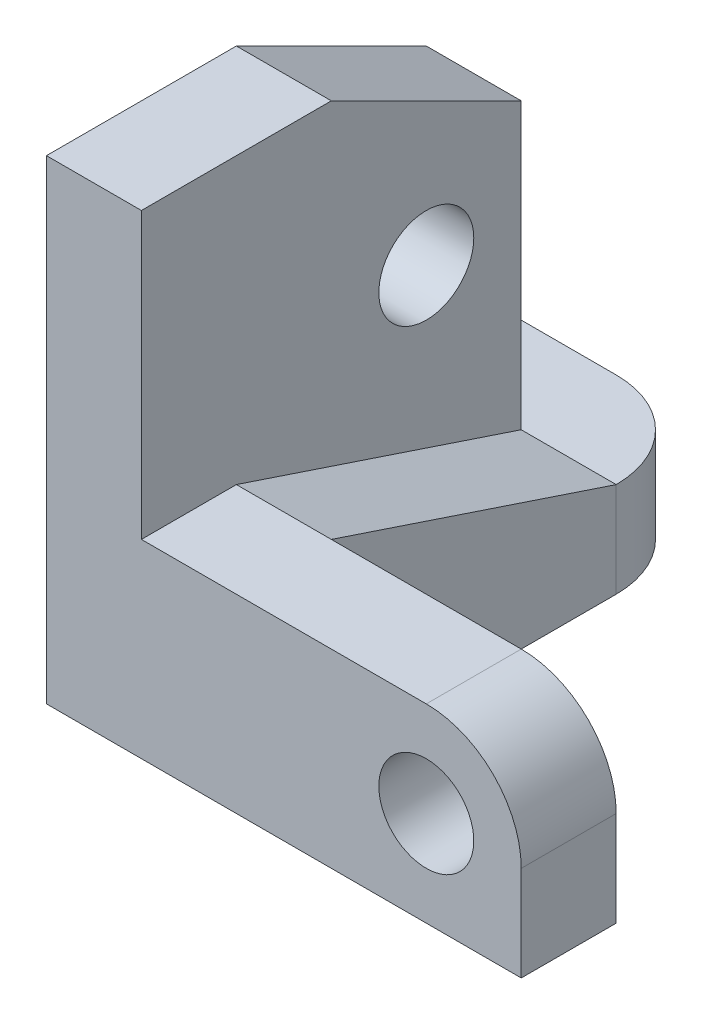
from build123d import *

# Parameters (mm, degrees)
SKETCH1_W           = 10
SKETCH1_H           = 20
BOSS_EXTRUDE1_DEPTH = 50
BOSS_EXTRUDE2_DEPTH = 20
SKETCH1_4_R         = 5
BOSS_EXTRUDE3_DEPTH = 10
FILLET1_R           = 10
SKETCH2_R           = 5
CUT_EXTRUDE1_DEPTH  = 10


with BuildPart() as part:
    # Sketch1 → Boss-Extrude1 (new body)
    with BuildSketch(Plane(origin=(0, 0, 0), x_dir=(0, 0, -1), z_dir=(1, 0, 0))):
        with Locations((-25, -20)):
            Rectangle(SKETCH1_W, SKETCH1_H)
    extrude(amount=BOSS_EXTRUDE1_DEPTH)

    # Sketch1<3> → Boss-Extrude2 (add)
    with BuildSketch(Plane(origin=(0, 0, 0), x_dir=(0, 0, -1), z_dir=(1, 0, 0))):
        Polygon((10, -20), (-20, -10), (-20, -30), (20, -30), (20, -20), align=None)
    extrude(amount=BOSS_EXTRUDE2_DEPTH)

    # Sketch1<4> → Boss-Extrude3 (add)
    with BuildSketch(Plane(origin=(0, 0, 0), x_dir=(0, 0, -1), z_dir=(1, 0, 0))):
        Polygon((-10, 20), (-30, 20), (-30, -10), (-20, -10), (10, -20), (10, 10), align=None)
        Circle(SKETCH1_4_R, mode=Mode.SUBTRACT)
    extrude(amount=BOSS_EXTRUDE3_DEPTH)

    # Fillet1
    fillet1_edges = [part.edges().sort_by_distance(p)[0] for p in [
        (50, -10, 25),
        (20, -25, -20),
    ]]
    fillet(fillet1_edges, radius=FILLET1_R)

    # Sketch2 → Cut-Extrude1 (cut)
    with BuildSketch(Plane(origin=(0, 0, 20), x_dir=(-1, 0, 0), z_dir=(0, 0, -1))):
        with Locations((-40, -20)):
            Circle(SKETCH2_R)
    extrude(amount=-CUT_EXTRUDE1_DEPTH, mode=Mode.SUBTRACT)


solid = part.part
